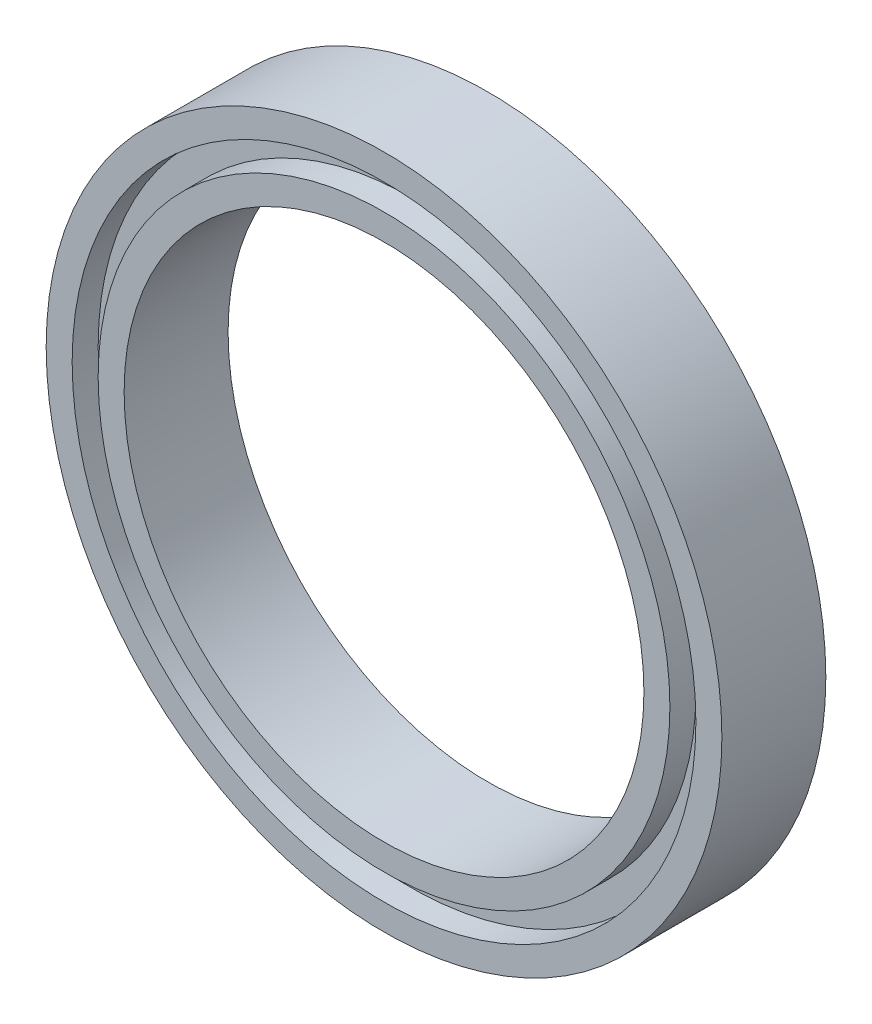
from build123d import *

# Parameters (mm, degrees)
SKETCH1_R           = 32.5
SKETCH1_R_2         = 25
BOSS_EXTRUDE1_DEPTH = 10
SKETCH2_R           = 30
SKETCH2_R_2         = 27.5
CUT_EXTRUDE1_DEPTH  = 2.5


with BuildPart() as part:
    # Sketch1 → Boss-Extrude1 (new body)
    with BuildSketch(Plane.XY):
        Circle(SKETCH1_R)
        Circle(SKETCH1_R_2, mode=Mode.SUBTRACT)
    extrude(amount=BOSS_EXTRUDE1_DEPTH)

    # Sketch2 → Cut-Extrude1 (cut)
    with BuildSketch(Plane.XY.offset(10)):
        Circle(SKETCH2_R)
        Circle(SKETCH2_R_2, mode=Mode.SUBTRACT)
    extrude(amount=-CUT_EXTRUDE1_DEPTH, mode=Mode.SUBTRACT)


solid = part.part
